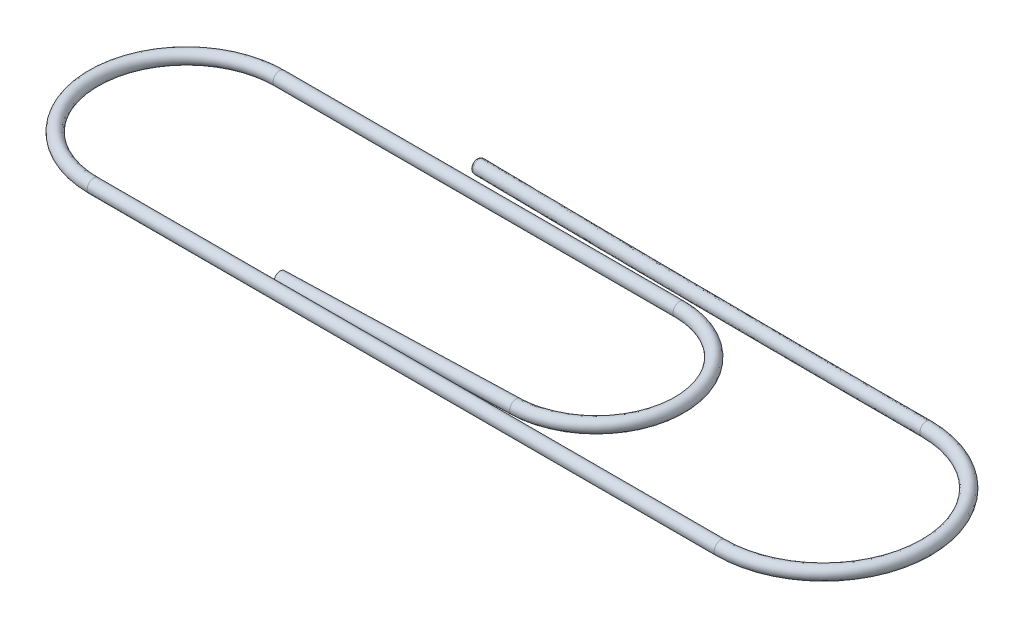
from build123d import *

# Parameters (mm, degrees)
SKETCH3_R = 0.25
FILLET1_R = 0.102616


with BuildPart() as part:
    # Sweep2: sweep along a path in Sketch1
    with BuildLine() as sweep2_path:  # in the path sketch's own coordinates; laid on its plane below (add() does not lay a ready-made edge on the line's plane)
        Line((10.292700886, -7.451039056), (19.118883778, -7.173920534))
        ThreePointArc((19.118883778, -7.173920534), (22.224605119, -3.918426875), (19.01825, -0.761999961))
        Line((19.01825, -0.761999961), (3.58775, -0.761999961))
        ThreePointArc((3.58775, -0.761999961), (-2e-08, -4.34974998), (3.58775, -7.9375))
        Line((3.58775, -7.9375), (27.78125, -7.9375))
        ThreePointArc((27.78125, -7.9375), (31.75, -3.96875), (27.78125, 0))
        add(Edge.make_bspline(
            [(27.78125, 0), (19.036691437, 0), (10.292700886, 0.140952795)],
            knots=[0, 0, 0, 1, 1, 1], degree=2))
    # Sketch3 → Sweep2 (sweep)
    with BuildSketch(Plane(origin=(10.292700886, 0, 0), x_dir=(0, 0, -1), z_dir=(1, 0, 0))):
        with Locations((0.140952795, 0)):
            Circle(SKETCH3_R)
    sweep(path=Plane(origin=(0, 0, 0), x_dir=(1, 0, 0), z_dir=(0, 1, 0)) * sweep2_path.line)

    # Fillet1
    fillet1_edges = [part.edges().sort_by_distance(p)[0] for p in [
        (10.292700886, 0, 0.109047204),
    ]]
    fillet(fillet1_edges, radius=FILLET1_R)


solid = part.part
